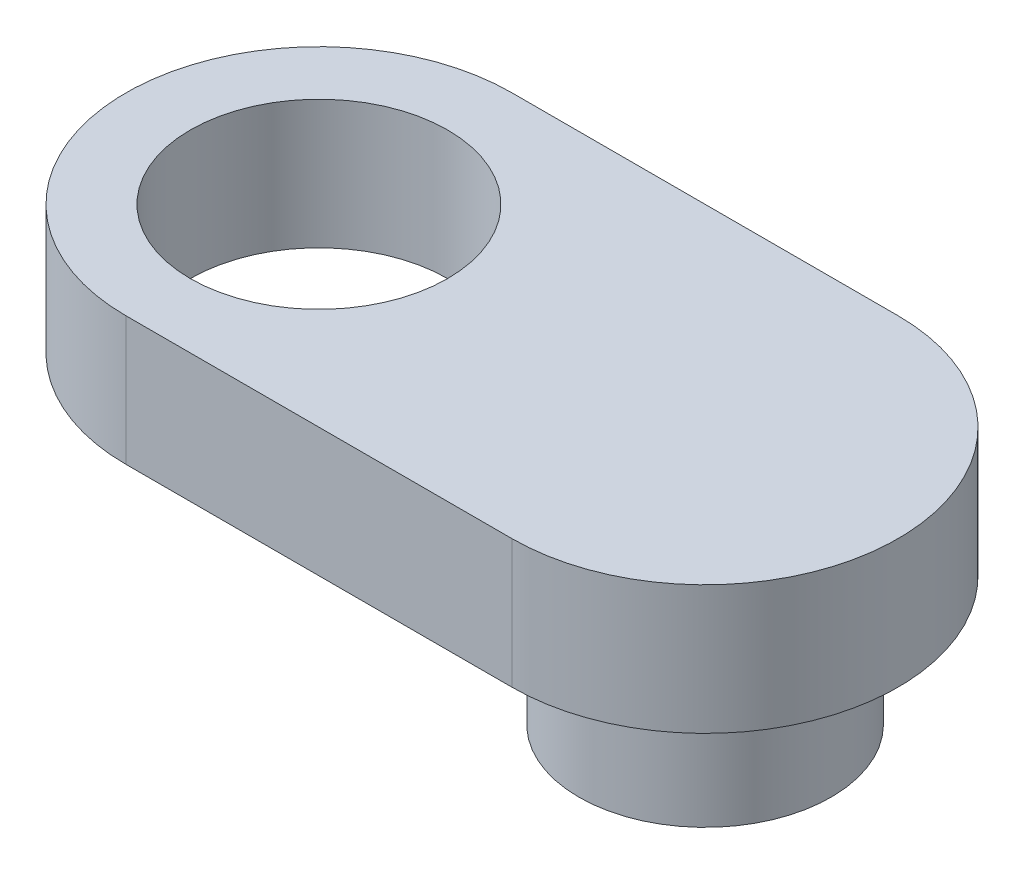
from build123d import *

# Parameters (mm, degrees)
SKETCH1_R           = 5
BOSS_EXTRUDE1_DEPTH = 5
SKETCH2_R           = 4.9
BOSS_EXTRUDE2_DEPTH = 10
BOSS_EXTRUDE3_START = -1
SKETCH4_R           = 5
BOSS_EXTRUDE3_DEPTH = 1


with BuildPart() as part:
    # Sketch1 → Boss-Extrude1 (new body)
    with BuildSketch(Plane(origin=(0, 0, 0), x_dir=(1, 0, 0), z_dir=(0, 1, 0))):
        with BuildLine():
            Line((0, 0), (15, 0))
            ThreePointArc((15, 0), (22.5, 7.5), (15, 15))
            Line((15, 15), (0, 15))
            ThreePointArc((0, 15), (-7.5, 7.5), (0, 0))
        make_face()
        with Locations(Location((0, 7.5, 0), (0, 0, 270))):
            Circle(SKETCH1_R, mode=Mode.SUBTRACT)
        with Locations(Location((15, 7.5, 0), (0, 0, 270))):
            Circle(SKETCH1_R, mode=Mode.SUBTRACT)
    extrude(amount=BOSS_EXTRUDE1_DEPTH)



with BuildPart() as body_2:
    # Sketch2 → Boss-Extrude2 (new body)
    with BuildSketch(Plane(origin=(0, 5, 0), x_dir=(1, 0, 0), z_dir=(0, 1, 0))):
        with Locations(Location((15, 7.5, 0), (0, 0, 270))):
            Circle(SKETCH2_R)
    extrude(amount=-BOSS_EXTRUDE2_DEPTH)


with BuildPart() as part_1:
    add(part.part)

    add(body_2.part)  # Boss-Extrude3 merges body 2
    # Sketch4 → Boss-Extrude3 (add)
    with BuildSketch(Plane(origin=(0, 5, 0), x_dir=(-1, 0, 0), z_dir=(0, 1, 0)).offset(BOSS_EXTRUDE3_START)):
        with Locations(Location((-15, -7.5, 0), (0, 0, 90))):
            Circle(SKETCH4_R)
    extrude(amount=BOSS_EXTRUDE3_DEPTH)


solid = part_1.part
